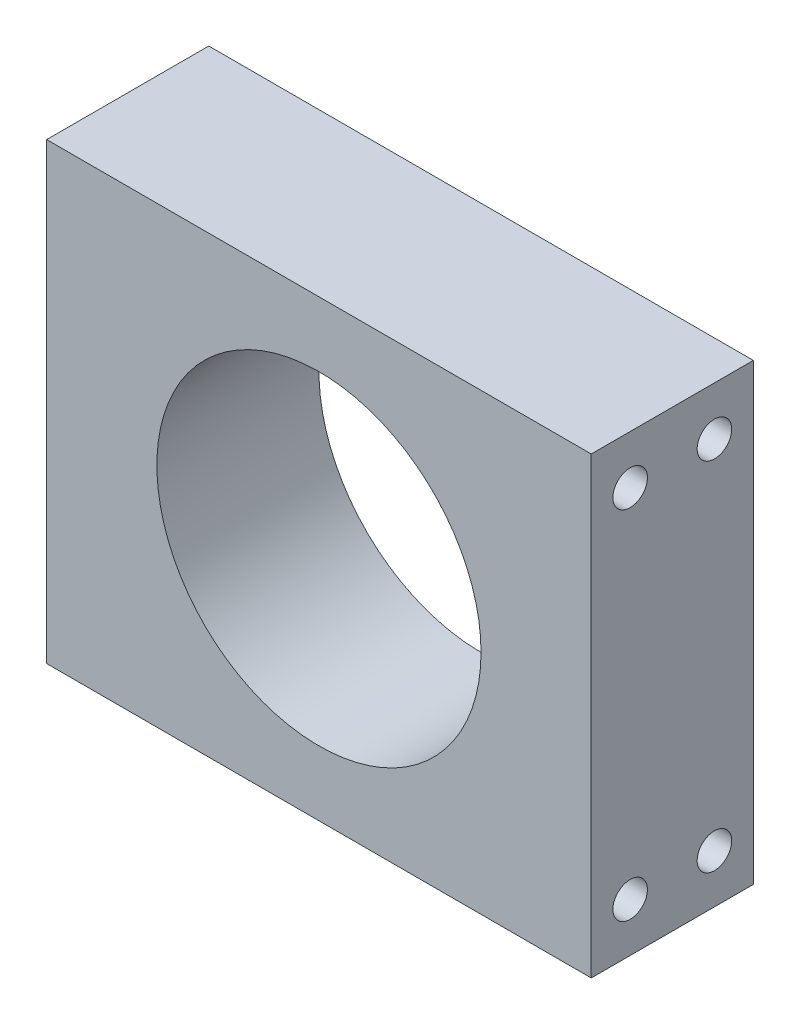
from build123d import *

# Parameters (mm, degrees)
SKETCH2_W                          = 42.672
SKETCH2_H                          = 35.56
SKETCH2_R                          = 12.7
BOSS_EXTRUDE1_DEPTH                = 12.7
TAP_DRILL_FOR_6_32_TAP1_AT_2_COUNT = 2
TAP_DRILL_FOR_6_32_TAP1_AT_2_PITCH = 27.94
TAP_DRILL_FOR_6_32_TAP1_AT_3_COUNT = 2
TAP_DRILL_FOR_6_32_TAP1_AT_3_PITCH = 6.604
TAP_DRILL_FOR_6_32_TAP1_AT_4_COUNT = 2
TAP_DRILL_FOR_6_32_TAP1_AT_4_PITCH = 28.709866179


with BuildPart() as part:
    # Sketch2 → Boss-Extrude1 (new body)
    with BuildSketch(Plane.XY):
        Rectangle(SKETCH2_W, SKETCH2_H)
        Circle(SKETCH2_R, mode=Mode.SUBTRACT)
    extrude(amount=BOSS_EXTRUDE1_DEPTH)

    # Sketch4 → Tap Drill for #6-32 Tap1 (revolve, cut)
    with BuildSketch(Plane(origin=(21.336, 13.97, 3.048), x_dir=(0, 0, -1), z_dir=(0, 1, 0))):
        Polygon((0, 0), (0, 7.16269403), (1.35255, 6.35), (1.35255, 0), align=None)
    tap_drill_for_6_32_tap1 = revolve(axis=Axis((27.686, 13.97, 3.048), (-1, 0, 0)), mode=Mode.SUBTRACT)

    # Tap Drill for #6-32 Tap1 at 2: Tap Drill for #6-32 Tap1 ×2
    with Locations(*[(0, -i * TAP_DRILL_FOR_6_32_TAP1_AT_2_PITCH, 0) for i in range(1, TAP_DRILL_FOR_6_32_TAP1_AT_2_COUNT)]):
        add(tap_drill_for_6_32_tap1, mode=Mode.SUBTRACT)

    # Tap Drill for #6-32 Tap1 at 3: Tap Drill for #6-32 Tap1 ×2
    with Locations(*[(0, 0, i * TAP_DRILL_FOR_6_32_TAP1_AT_3_PITCH) for i in range(1, TAP_DRILL_FOR_6_32_TAP1_AT_3_COUNT)]):
        add(tap_drill_for_6_32_tap1, mode=Mode.SUBTRACT)

    # Tap Drill for #6-32 Tap1 at 4: Tap Drill for #6-32 Tap1 ×2
    with Locations(*[Vector(0, -0.9731846127764102, 0.23002545392896967) * (i * TAP_DRILL_FOR_6_32_TAP1_AT_4_PITCH) for i in range(1, TAP_DRILL_FOR_6_32_TAP1_AT_4_COUNT)]):
        add(tap_drill_for_6_32_tap1, mode=Mode.SUBTRACT)

    # Mirror1: Tap Drill for #6-32 Tap1 across plane
    add(tap_drill_for_6_32_tap1.mirror(Plane(origin=(0, 0, 0), x_dir=(0, 0, 1), z_dir=(1, 0, 0))), mode=Mode.SUBTRACT)

    # Mirror1 copy 1 sketch → Mirror1 copy 1 (revolve, cut)
    with BuildSketch(Plane(origin=(-21.336, -13.97, 3.048), x_dir=(0, 0, -1), z_dir=(0, 1, 0))):
        Polygon((0, 0), (0, -7.16269403), (1.35255, -6.35), (1.35255, 0), align=None)
    revolve(axis=Axis((-27.686, -13.97, 3.048), (-1, 0, 0)), mode=Mode.SUBTRACT)

    # Mirror1 copy 2 sketch → Mirror1 copy 2 (revolve, cut)
    with BuildSketch(Plane(origin=(-21.336, 13.97, 9.652), x_dir=(0, 0, -1), z_dir=(0, 1, 0))):
        Polygon((0, 0), (0, -7.16269403), (1.35255, -6.35), (1.35255, 0), align=None)
    revolve(axis=Axis((-27.686, 13.97, 9.652), (-1, 0, 0)), mode=Mode.SUBTRACT)

    # Mirror1 copy 3 sketch → Mirror1 copy 3 (revolve, cut)
    with BuildSketch(Plane(origin=(-21.336, -13.97, 9.652), x_dir=(0, 0, -1), z_dir=(0, 1, 0))):
        Polygon((0, 0), (0, -7.16269403), (1.35255, -6.35), (1.35255, 0), align=None)
    revolve(axis=Axis((-27.686, -13.97, 9.652), (-1, 0, 0)), mode=Mode.SUBTRACT)


solid = part.part
